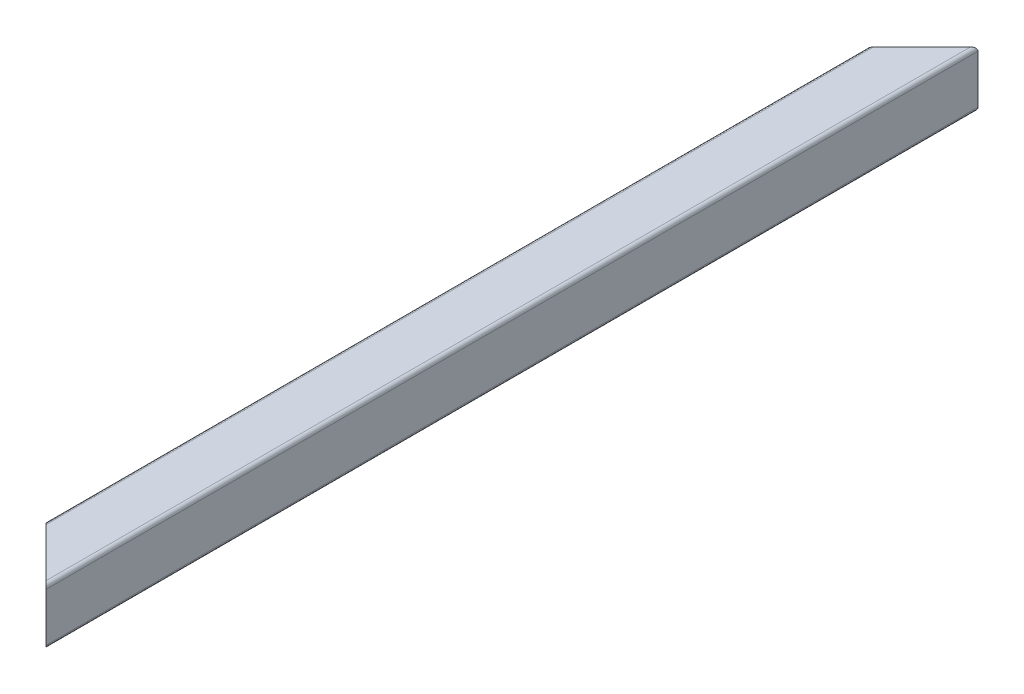
from build123d import *

# Parameters (mm, degrees)
Y_KSEKLIK_EKSTR_ZYON1_DEPTH      = 250
Y_KSEKLIK_EKSTR_ZYON1_DEPTH_BACK = 250
IZIM1_W                          = 26
IZIM1_H                          = 26
KES_EKSTR_ZYON1_DEPTH            = 250
KES_EKSTR_ZYON1_DEPTH_BACK       = 250


with BuildPart() as part:
    # Çizim1 → Yükseklik-Ekstrüzyon1 (new, two sides: drawn at the far end of the back side and taken through both)
    with BuildSketch(Plane.XY.offset(-Y_KSEKLIK_EKSTR_ZYON1_DEPTH_BACK)):
        with BuildLine():
            Line((-13, 15), (13, 15))
            ThreePointArc((13, 15), (14.414213562, 14.414213562), (15, 13))
            Line((15, 13), (15, -13))
            ThreePointArc((15, -13), (14.414213562, -14.414213562), (13, -15))
            Line((13, -15), (-13, -15))
            ThreePointArc((-13, -15), (-14.414213562, -14.414213562), (-15, -13))
            Line((-15, -13), (-15, 13))
            ThreePointArc((-15, 13), (-14.414213562, 14.414213562), (-13, 15))
        make_face()
        Rectangle(IZIM1_W, IZIM1_H, mode=Mode.SUBTRACT)
    extrude(amount=Y_KSEKLIK_EKSTR_ZYON1_DEPTH + Y_KSEKLIK_EKSTR_ZYON1_DEPTH_BACK)

    # Çizim2 → Kes-Ekstrüzyon1 (cut, two sides: drawn at the far end of the back side and taken through both)
    with BuildSketch(Plane(origin=(0, 0, 0), x_dir=(1, 0, 0), z_dir=(0, 1, 0)).offset(-KES_EKSTR_ZYON1_DEPTH_BACK)):
        Polygon((15, 250), (-15, 220), (-15, 250), align=None)
        Polygon((15, -250), (-15, -220), (-15, -250), align=None)
    extrude(amount=KES_EKSTR_ZYON1_DEPTH + KES_EKSTR_ZYON1_DEPTH_BACK, mode=Mode.SUBTRACT)


solid = part.part
